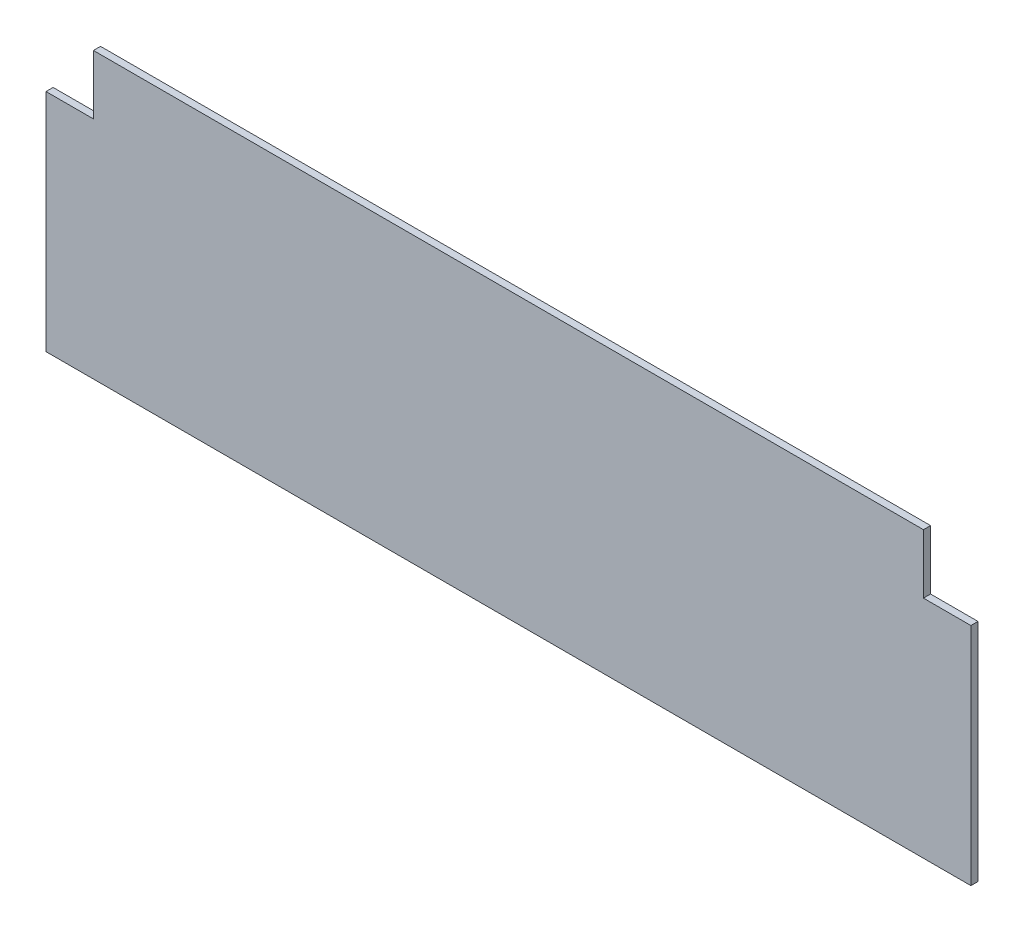
from build123d import *

# Parameters (mm, degrees)
EXTRUDE_1_DEPTH = 3


with BuildPart() as part:
    # 草图1 → 凸台-拉伸1 (new body)
    with BuildSketch(Plane.XY):
        Polygon((20, 5), (370, 5), (370, -20), (390, -20), (390, -115), (0, -115), (0, -20), (20, -20), align=None)
    extrude(amount=EXTRUDE_1_DEPTH)


solid = part.part
